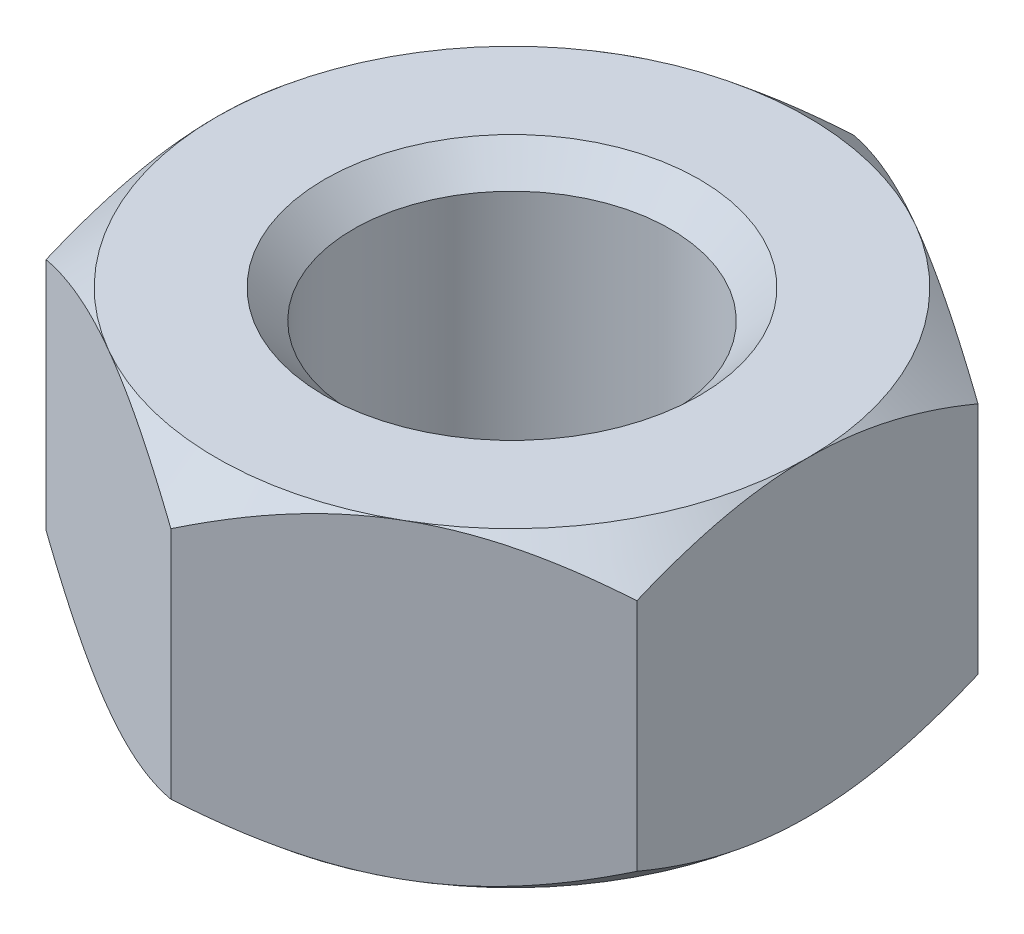
from build123d import *

# Parameters (mm, degrees)
BOSS_EXTRUDE1_DEPTH     = 5
SKETCH5_OUTSIDE_W       = 50.974
SKETCH5_OUTSIDE_H       = 53.914
SKETCH5_OUTSIDE_R       = 9.5
CUT_EXTRUDE1_DEPTH      = 10
CUT_EXTRUDE1_DRAFT      = -50
MIRROR1_COPY_1_SKETCH_W = 50.974
MIRROR1_COPY_1_SKETCH_H = 53.914
MIRROR1_COPY_1_SKETCH_R = 9.5
MIRROR1_COPY_1_DEPTH    = 10
MIRROR1_COPY_1_DRAFT    = -50


with BuildPart() as part:
    # Sketch1 → Boss-Extrude1 (new, symmetric)
    with BuildSketch(Plane(origin=(0, 0, 0), x_dir=(1, 0, 0), z_dir=(0, 1, 0))):
        Polygon((0, 10.969655115), (-9.5, 5.484827557), (-9.5, -5.484827557), (0, -10.969655115), (9.5, -5.484827557), (9.5, 5.484827557), align=None)
    extrude(amount=BOSS_EXTRUDE1_DEPTH, both=True)

    # Sketch4 → M12 Tapped Hole1 (revolve, cut)
    with BuildSketch(Plane(origin=(0, 5, 0), x_dir=(0, 0, 1), z_dir=(1, 0, 0))):
        Polygon((0, 0), (0, 10), (6.025, 10), (5.1, 9.075), (5.1, 0.925), (6.025, 0), align=None)
    revolve(axis=Axis((0, 11.35, 0), (0, -1, 0)), mode=Mode.SUBTRACT)


with BuildPart() as cut_extrude1_tool:
    # Sketch5 outside → Cut-Extrude1 (with draft: the straight prism first)
    with BuildSketch(Plane(origin=(0, 5, 0), x_dir=(1, 0, 0), z_dir=(0, 1, 0))):
        Rectangle(SKETCH5_OUTSIDE_W, SKETCH5_OUTSIDE_H)
        Circle(SKETCH5_OUTSIDE_R, mode=Mode.SUBTRACT)
    extrude(amount=-CUT_EXTRUDE1_DEPTH)
    # Cut-Extrude1: the draft: its side faces are tilted about the plane it starts from
    cut_extrude1_sides = [cut_extrude1_tool.faces().sort_by_distance(p)[0] for p in [
        (0, 0, 26.957),
        (25.487, 0, 0),
        (0, 0, -26.957),
        (-25.487, 0, 0),
        (-9.5, 0, 0),
    ]]
    draft(cut_extrude1_sides, Plane(origin=(0, 5, 0), x_dir=(1, 0, 0), z_dir=(0, 1, 0)), CUT_EXTRUDE1_DRAFT)


with BuildPart() as part_1:
    add(part.part)

    # Cut-Extrude1: cut by cut_extrude1_tool
    add(cut_extrude1_tool.part, mode=Mode.SUBTRACT)


with BuildPart() as mirror1_copy_1_tool:
    # Mirror1 copy 1 sketch → Mirror1 copy 1 (with draft: the straight prism first)
    with BuildSketch(Plane.XZ.offset(5)):
        Rectangle(MIRROR1_COPY_1_SKETCH_W, MIRROR1_COPY_1_SKETCH_H)
        Circle(MIRROR1_COPY_1_SKETCH_R, mode=Mode.SUBTRACT)
    extrude(amount=-MIRROR1_COPY_1_DEPTH)
    # Mirror1 copy 1: the draft: its side faces are tilted about the plane it starts from
    mirror1_copy_1_sides = [mirror1_copy_1_tool.faces().sort_by_distance(p)[0] for p in [
        (0, 0, 26.957),
        (25.487, 0, 0),
        (0, 0, -26.957),
        (-25.487, 0, 0),
        (-9.5, 0, 0),
    ]]
    draft(mirror1_copy_1_sides, Plane.XZ.offset(5), MIRROR1_COPY_1_DRAFT)


with BuildPart() as part_2:
    add(part_1.part)

    # Mirror1 copy 1: cut by mirror1_copy_1_tool
    add(mirror1_copy_1_tool.part, mode=Mode.SUBTRACT)


solid = part_2.part
